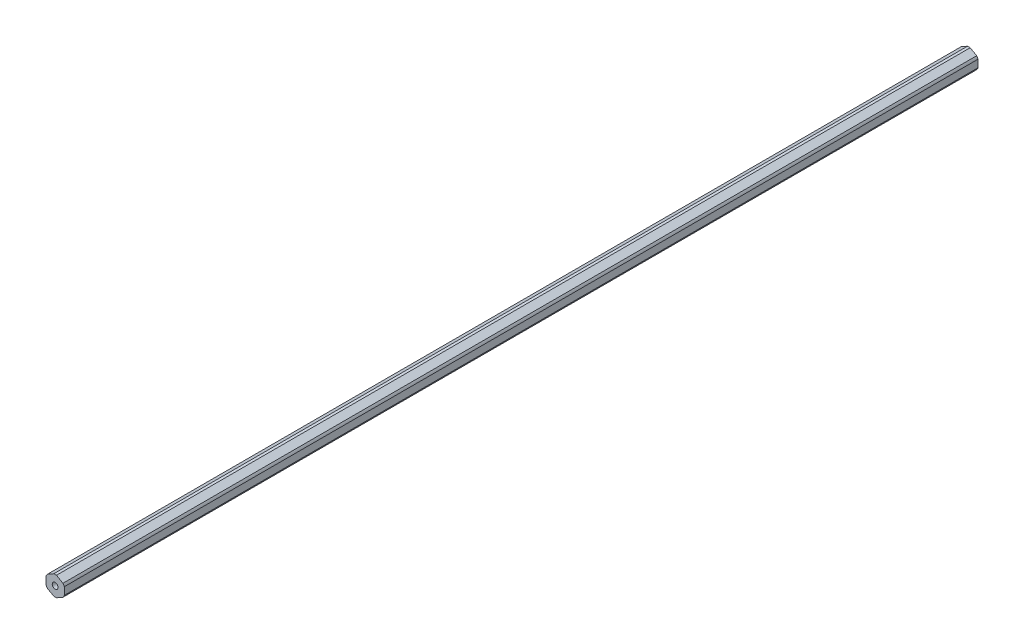
from build123d import *

# Parameters (mm, degrees)
BOSS_EXTRUDE1_DEPTH                  = 317.5
F_10_32_TAPPED_HOLE1_D               = 4.0386
F_10_32_TAPPED_HOLE1_DEPTH           = 11.938
F_10_32_TAPPED_HOLE1_TIP             = 1.213317848
F_10_32_TAPPED_HOLE1_ON_FACE_2_D     = 4.0386
F_10_32_TAPPED_HOLE1_ON_FACE_2_DEPTH = 11.938
F_10_32_TAPPED_HOLE1_ON_FACE_2_TIP   = 1.213317848


with BuildPart() as part:
    # Sketch1 → Boss-Extrude1 (new, symmetric)
    with BuildSketch(Plane.XY):
        with BuildLine():
            ThreePointArc((0.93173274, 6.79441227), (0, 6.858), (-0.93173274, 6.79441227))
            Line((-0.93173274, 6.79441227), (-5.41826726, 4.204110358))
            ThreePointArc((-5.41826726, 4.204110358), (-5.939202219, 3.429), (-6.35, 2.590301913))
            Line((-6.35, 2.590301913), (-6.35, -2.590301913))
            ThreePointArc((-6.35, -2.590301913), (-5.939202219, -3.429), (-5.41826726, -4.204110358))
            Line((-5.41826726, -4.204110358), (-0.93173274, -6.79441227))
            ThreePointArc((-0.93173274, -6.79441227), (0, -6.858), (0.93173274, -6.79441227))
            Line((0.93173274, -6.79441227), (5.41826726, -4.204110358))
            ThreePointArc((5.41826726, -4.204110358), (5.939202219, -3.429), (6.35, -2.590301913))
            Line((6.35, -2.590301913), (6.35, 2.590301913))
            ThreePointArc((6.35, 2.590301913), (5.939202219, 3.429), (5.41826726, 4.204110358))
            Line((5.41826726, 4.204110358), (0.93173274, 6.79441227))
        make_face()
    extrude(amount=BOSS_EXTRUDE1_DEPTH, both=True)

    # #10-32 Tapped Hole1
    with Locations(Plane.XY.offset(317.5)):
        with Locations((0, 0)):
            Hole(F_10_32_TAPPED_HOLE1_D / 2, depth=F_10_32_TAPPED_HOLE1_DEPTH)
            with Locations((0, 0, -(F_10_32_TAPPED_HOLE1_DEPTH + F_10_32_TAPPED_HOLE1_TIP / 2))):  # 118° drill point
                Cone(0, F_10_32_TAPPED_HOLE1_D / 2, F_10_32_TAPPED_HOLE1_TIP, mode=Mode.SUBTRACT)

    # #10-32 Tapped Hole1 on face 2
    with Locations(Plane(origin=(0, 0, -317.5), x_dir=(-1, 0, 0), z_dir=(0, 0, -1))):
        with Locations((0, 0)):
            Hole(F_10_32_TAPPED_HOLE1_ON_FACE_2_D / 2, depth=F_10_32_TAPPED_HOLE1_ON_FACE_2_DEPTH)
            with Locations((0, 0, -(F_10_32_TAPPED_HOLE1_ON_FACE_2_DEPTH + F_10_32_TAPPED_HOLE1_ON_FACE_2_TIP / 2))):  # 118° drill point
                Cone(0, F_10_32_TAPPED_HOLE1_ON_FACE_2_D / 2, F_10_32_TAPPED_HOLE1_ON_FACE_2_TIP, mode=Mode.SUBTRACT)


solid = part.part
